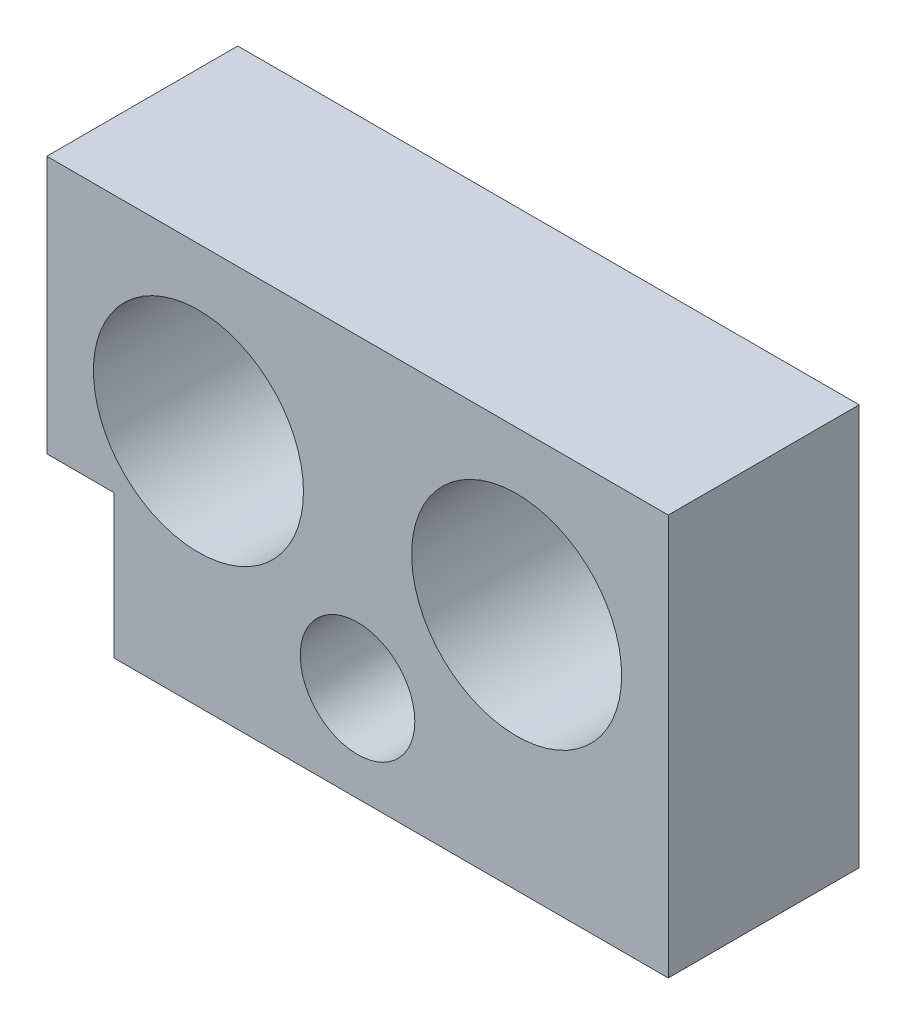
from build123d import *

# Parameters (mm, degrees)
PARALLELEPIPEDOBLOCCO_DEPTH  = 20
SCHIZZO2_R                   = 11
SCHIZZO2_R_2                 = 6
FORITUBIMOTORI_DEPTH         = 46.656352242
SCHIZZO3_W                   = 7.05
SCHIZZO3_H                   = 15
SPAZIOMOVIMENTOLEVETTA_DEPTH = 46.656352242


with BuildPart() as part:
    # Schizzo1 → ParallelepipedoBlocco (new body)
    with BuildSketch(Plane.XY):
        Polygon((-30.55, -25), (30.55, -25), (32.55, -25), (32.55, 17), (-32.55, 17), (-32.55, -25), align=None)
    extrude(amount=PARALLELEPIPEDOBLOCCO_DEPTH)

    # Schizzo2 → ForiTubiMotori (cut, through all)
    with BuildSketch(Plane.XY.offset(20)):
        with Locations((-16.665, 0)):
            Circle(SCHIZZO2_R)
        with Locations((16.665, 0)):
            Circle(SCHIZZO2_R)
        with Locations((0, -15)):
            Circle(SCHIZZO2_R_2)
    extrude(amount=-FORITUBIMOTORI_DEPTH, mode=Mode.SUBTRACT)

    # Schizzo3 → SpazioMovimentoLevetta (cut, through all)
    with BuildSketch(Plane.XY.offset(20)):
        with Locations((-29.025, -17.5)):
            Rectangle(SCHIZZO3_W, SCHIZZO3_H)
    extrude(amount=-SPAZIOMOVIMENTOLEVETTA_DEPTH, mode=Mode.SUBTRACT)


solid = part.part
